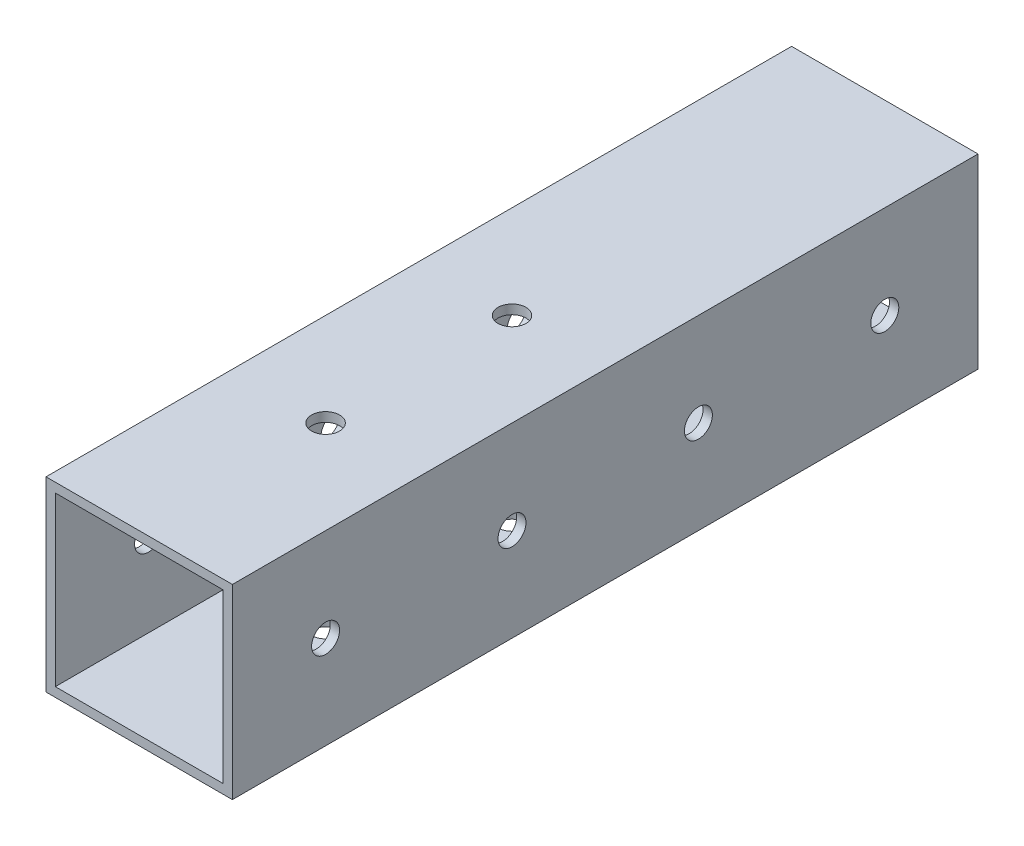
from build123d import *

# Parameters (mm, degrees)
SKETCH_1_W          = 20
SKETCH_1_H          = 20
SKETCH_1_W_2        = 18
SKETCH_1_H_2        = 18
EXTRUDE_1_DEPTH     = 40
SKETCH_2_R          = 1.5
CUT_EXTRUDE_1_DEPTH = 200
SKETCH_3_R          = 1.5
CUT_EXTRUDE_2_DEPTH = 40


with BuildPart() as part:
    # 草图1 → 凸台-拉伸1 (new, symmetric)
    with BuildSketch(Plane.XY):
        Rectangle(SKETCH_1_W, SKETCH_1_H)
        Rectangle(SKETCH_1_W_2, SKETCH_1_H_2, mode=Mode.SUBTRACT)
    extrude(amount=EXTRUDE_1_DEPTH, both=True)

    # 草图2 → 切除-拉伸1 (cut)
    with BuildSketch(Plane(origin=(0, 10, 0), x_dir=(1, 0, 0), z_dir=(0, 1, 0))):
        with Locations(Location((0, -20, 0), (0, 0, 270))):
            Circle(SKETCH_2_R)
        with Locations(Location((0, 0, 0), (0, 0, 270))):
            Circle(SKETCH_2_R)
    extrude(amount=-CUT_EXTRUDE_1_DEPTH, mode=Mode.SUBTRACT)

    # 草图3 → 切除-拉伸2 (cut)
    with BuildSketch(Plane.ZY.offset(10)):
        with Locations((10, 0)):
            Circle(SKETCH_3_R)
        with Locations((-10, 0)):
            Circle(SKETCH_3_R)
        with Locations((30, 0)):
            Circle(SKETCH_3_R)
        with Locations((-30, 0)):
            Circle(SKETCH_3_R)
    extrude(amount=-CUT_EXTRUDE_2_DEPTH, mode=Mode.SUBTRACT)


solid = part.part
